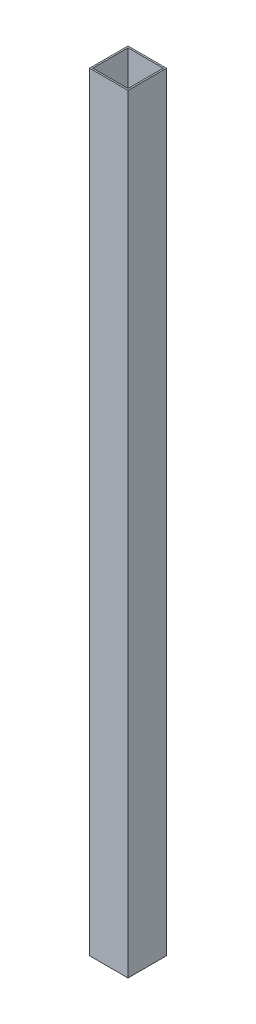
from build123d import *

# Parameters (mm, degrees)
SKETCH1_W           = 50
SKETCH1_H           = 50
SKETCH1_W_2         = 46
SKETCH1_H_2         = 46
BOSS_EXTRUDE1_DEPTH = 1000


with BuildPart() as part:
    # Sketch1 → Boss-Extrude1 (new body)
    with BuildSketch(Plane(origin=(0, 0, 0), x_dir=(1, 0, 0), z_dir=(0, 1, 0))):
        Rectangle(SKETCH1_W, SKETCH1_H)
        Rectangle(SKETCH1_W_2, SKETCH1_H_2, mode=Mode.SUBTRACT)
    extrude(amount=BOSS_EXTRUDE1_DEPTH)


solid = part.part
